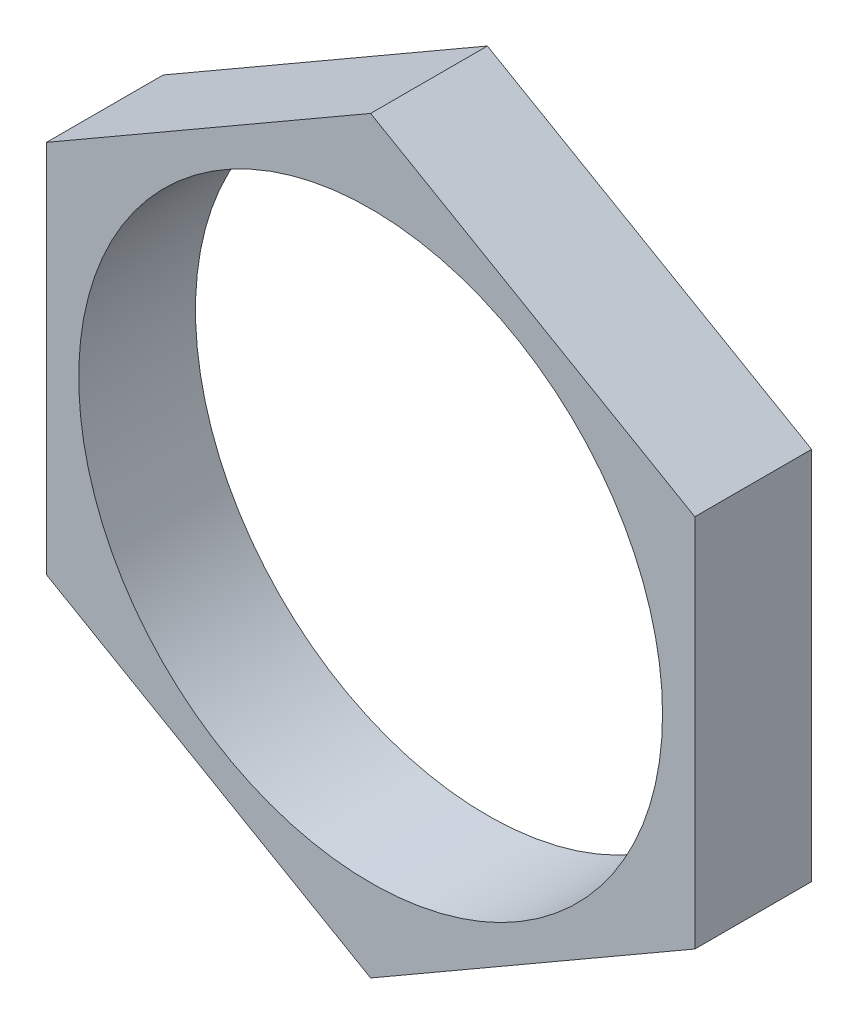
from build123d import *

# Parameters (mm, degrees)
SKETCH1_R           = 10
BOSS_EXTRUDE1_DEPTH = 4


with BuildPart() as part:
    # Sketch1 → Boss-Extrude1 (new body)
    with BuildSketch(Plane.XY):
        Polygon((0, 12.824438475), (-11.106289509, 6.412219238), (-11.106289509, -6.412219238), (0, -12.824438475), (11.106289509, -6.412219238), (11.106289509, 6.412219238), align=None)
        Circle(SKETCH1_R, mode=Mode.SUBTRACT)
    extrude(amount=BOSS_EXTRUDE1_DEPTH)


solid = part.part
